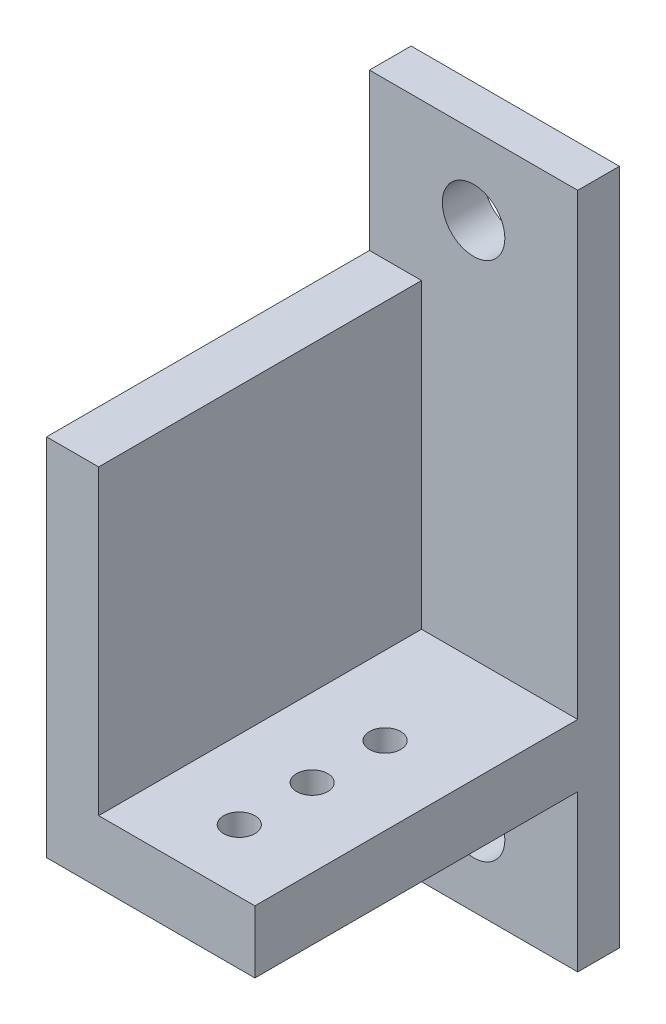
from build123d import *

# Parameters (mm, degrees)
BOSS_EXTRUDE1_DEPTH = 35
SKETCH3_R           = 1.5
CUT_EXTRUDE1_DEPTH  = 15
LPATTERN1_COUNT     = 3
LPATTERN1_PITCH     = 7
SKETCH6_W           = 15
SKETCH6_H           = 35
SKETCH6_R           = 1.5
BOSS_EXTRUDE4_DEPTH = 6
SKETCH7_W           = 15
SKETCH7_H           = 35
CUT_EXTRUDE2_DEPTH  = 8
SKETCH2_W           = 4
SKETCH2_H           = 35
BOSS_EXTRUDE5_DEPTH = 20
BOSS_EXTRUDE6_DEPTH = 15
SKETCH10_W          = 20
SKETCH10_H          = 4
BOSS_EXTRUDE7_DEPTH = 15
SKETCH11_R          = 3
CUT_EXTRUDE3_DEPTH  = 15


with BuildPart() as part:
    # Sketch1 → Boss-Extrude1 (new body)
    with BuildSketch(Plane.XY):
        Polygon((12.368951074, 15.64566438), (-2.631048926, 15.64566438), (-2.631048926, -13.35433562), (-7.631048926, -13.35433562), (-7.631048926, 21.64566438), (12.368951074, 21.64566438), align=None)
    extrude(amount=BOSS_EXTRUDE1_DEPTH)

    # Sketch3 → Cut-Extrude1 (cut)
    with BuildSketch(Plane.XZ.offset(-15.64566438)):
        with Locations((4.868951074, 29)):
            Circle(SKETCH3_R)
    cut_extrude1 = extrude(amount=-CUT_EXTRUDE1_DEPTH, mode=Mode.SUBTRACT)

    # LPattern1: Cut-Extrude1 ×3
    with Locations(*[(0, 0, -i * LPATTERN1_PITCH) for i in range(1, LPATTERN1_COUNT)]):
        add(cut_extrude1, mode=Mode.SUBTRACT)

    # Sketch6 → Boss-Extrude4 (add)
    with BuildSketch(Plane.XZ.offset(13.35433562)):
        with Locations((4.868951074, 17.5)):
            Rectangle(SKETCH6_W, SKETCH6_H)
        with Locations((4.868951074, 15)):
            Circle(SKETCH6_R, mode=Mode.SUBTRACT)
        with Locations((4.868951074, 29)):
            Circle(SKETCH6_R, mode=Mode.SUBTRACT)
        with Locations((4.868951074, 22)):
            Circle(SKETCH6_R, mode=Mode.SUBTRACT)
    extrude(amount=-BOSS_EXTRUDE4_DEPTH)

    # Sketch7 → Cut-Extrude2 (cut)
    with BuildSketch(Plane.XZ.offset(-15.64566438)):
        with Locations((4.868951074, 17.5)):
            Rectangle(SKETCH7_W, SKETCH7_H)
    extrude(amount=-CUT_EXTRUDE2_DEPTH, mode=Mode.SUBTRACT)

    # Sketch2 → Boss-Extrude5 (add)
    with BuildSketch(Plane.ZY.offset(7.631048926)):
        with Locations((2, 4.14566438)):
            Rectangle(SKETCH2_W, SKETCH2_H)
    extrude(amount=-BOSS_EXTRUDE5_DEPTH)

    # Sketch9 → Boss-Extrude6 (add)
    with BuildSketch(Plane(origin=(0, 21.64566438, 0), x_dir=(1, 0, 0), z_dir=(0, 1, 0))):
        Polygon((-2.631048926, -4), (-7.631048926, -4), (-7.631048926, 0), (12.368951074, 0), (12.368951074, -4), align=None)
    extrude(amount=BOSS_EXTRUDE6_DEPTH)

    # Sketch10 → Boss-Extrude7 (add)
    with BuildSketch(Plane.XZ.offset(13.35433562)):
        with Locations((2.368951074, 2)):
            Rectangle(SKETCH10_W, SKETCH10_H)
    extrude(amount=BOSS_EXTRUDE7_DEPTH)

    # Sketch11 → Cut-Extrude3 (cut)
    with BuildSketch(Plane.XY.offset(4)):
        with Locations((2.368951074, -20.85433562)):
            Circle(SKETCH11_R)
        with Locations((2.368951074, 29.14566438)):
            Circle(SKETCH11_R)
    extrude(amount=-CUT_EXTRUDE3_DEPTH, mode=Mode.SUBTRACT)


solid = part.part
